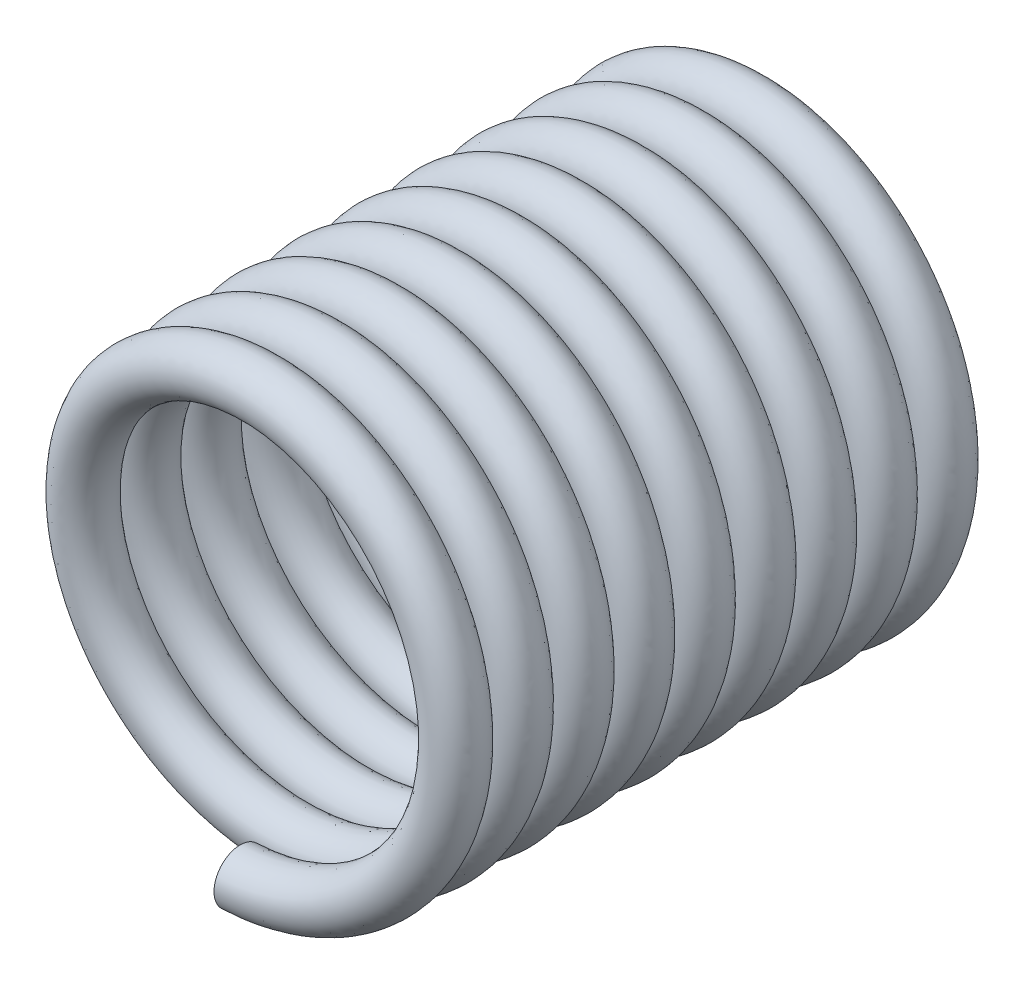
from build123d import *

# Parameters (mm, degrees)
SWEEP1_PITCH       = 1.143725714
SWEEP1_HEIGHT      = 10.0076
SWEEP1_RADIUS      = 4.0005
SWEEP1_START_ANGLE = -180
SKETCH2_R          = 0.4953


with BuildPart() as part:
    # Sweep1: sweep along a helix
    with BuildLine() as sweep1_path:
        add(Helix(SWEEP1_PITCH, SWEEP1_HEIGHT, SWEEP1_RADIUS, center=(0, 0, 0), direction=(0, 0, 1), lefthand=True, mode=Mode.PRIVATE).rotate(Axis((0, 0, 0), (0, 0, 1)), SWEEP1_START_ANGLE))
    # Sketch2 → Sweep1 (sweep)
    with BuildSketch(Plane(origin=(0, -4.0005, 10.0076), x_dir=(0.045449541063973836, -0.015039595718082556, 0.9988534175632133), z_dir=(-0.9989664017777141, -1.2978789050432926e-13, 0.04545468203922035))):
        with Locations((0.001589314, 0.206647084)):
            Circle(SKETCH2_R)
    sweep(path=sweep1_path.line, is_frenet=True)


solid = part.part
